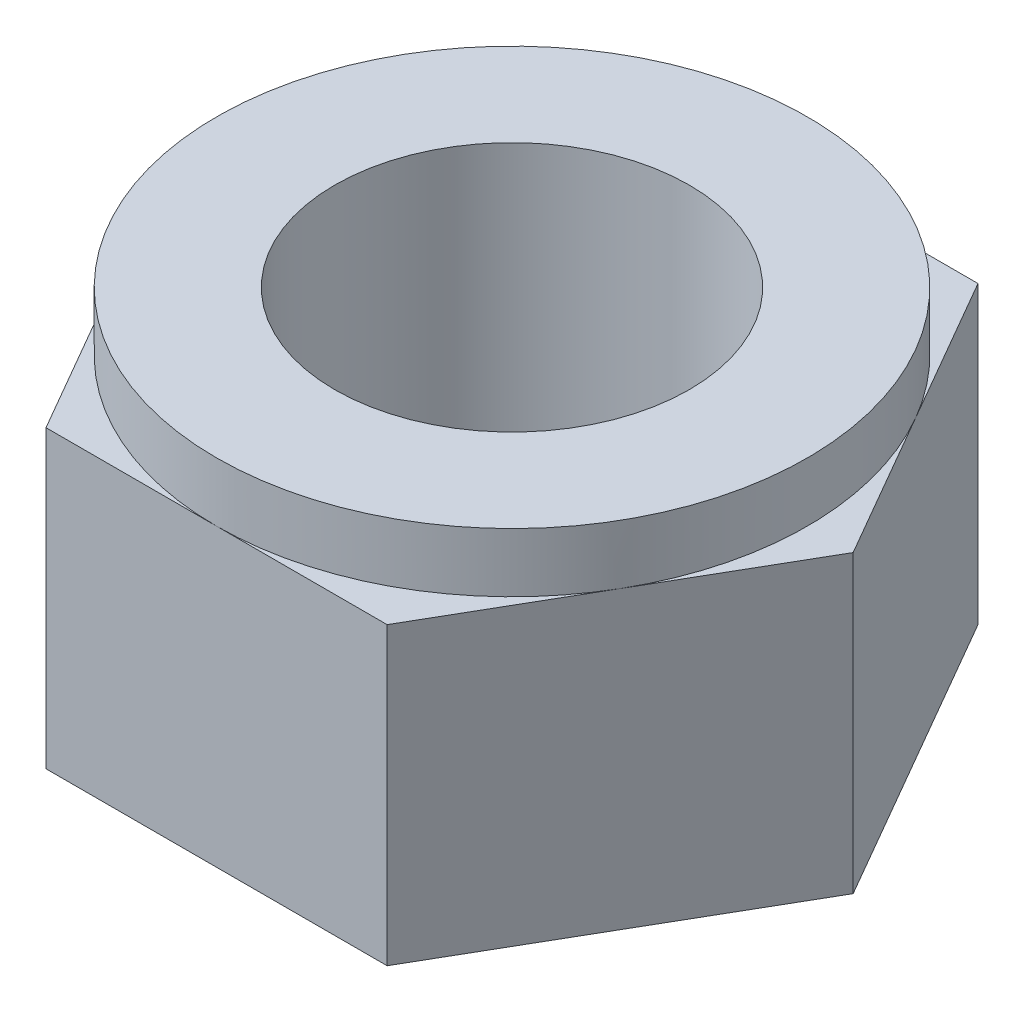
from build123d import *

# Parameters (mm, degrees)
EXTRUDE_1_DEPTH     = 5
SKETCH_2_R          = 5
EXTRUDE_2_DEPTH     = 1
SKETCH_3_R          = 3
CUT_EXTRUDE_1_DEPTH = 10.712534856


with BuildPart() as part:
    # 草图1 → 凸台-拉伸1 (new body)
    with BuildSketch(Plane(origin=(0, 0, 0), x_dir=(1, 0, 0), z_dir=(0, 1, 0))):
        Polygon((5.773502692, 0), (2.886751346, 5), (-2.886751346, 5), (-5.773502692, 0), (-2.886751346, -5), (2.886751346, -5), align=None)
    extrude(amount=EXTRUDE_1_DEPTH)

    # 草图2 → 凸台-拉伸2 (add)
    with BuildSketch(Plane(origin=(0, 5, 0), x_dir=(1, 0, 0), z_dir=(0, 1, 0))):
        Circle(SKETCH_2_R)
    extrude(amount=EXTRUDE_2_DEPTH)

    # 草图3 → 切除-拉伸1 (cut, through all)
    with BuildSketch(Plane.XZ):
        Circle(SKETCH_3_R)
    extrude(amount=-CUT_EXTRUDE_1_DEPTH, mode=Mode.SUBTRACT)


solid = part.part
